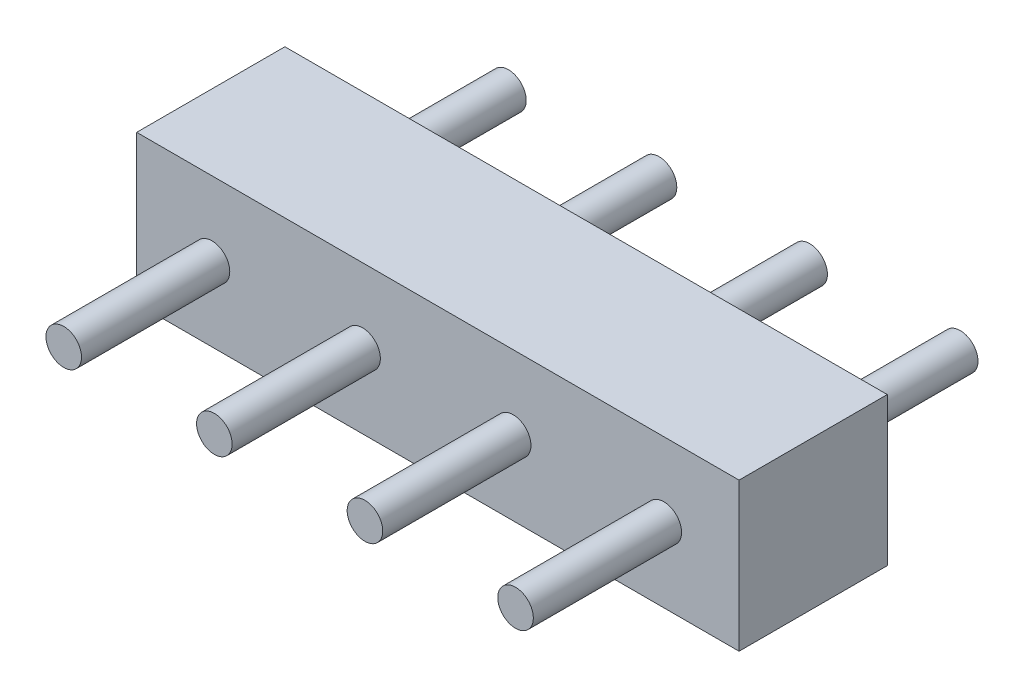
from build123d import *

# Parameters (mm, degrees)
SKETCH_1_W                 = 10.16
SKETCH_1_H                 = 2.5
EXTRUDE_1_DEPTH            = 2.5
EXTRUDE_START              = -5
SKETCH_2_R                 = 0.3
EXTRUDE_2_DEPTH            = 7.5
PATTERN_LINEAR_1_COUNT     = 3
PATTERN_LINEAR_1_PITCH     = 2.54
PATTERN_LINEAR_1_COL_COUNT = 2
PATTERN_LINEAR_1_COL_PITCH = 2.54


with BuildPart() as part:
    # 草图1 → 凸台-拉伸1 (new body)
    with BuildSketch(Plane.XY):
        with Locations((5.08, 1.25)):
            Rectangle(SKETCH_1_W, SKETCH_1_H)
    extrude(amount=EXTRUDE_1_DEPTH)

    # 草图2 → 凸台-拉伸2 (add)
    with BuildSketch(Plane.XY.offset(2.5).offset(EXTRUDE_START)):
        with Locations((3.81, 1.25)):
            Circle(SKETCH_2_R)
    extrude_2 = extrude(amount=EXTRUDE_2_DEPTH)

    # 阵列(线性)1: 凸台-拉伸2 ×3
    with Locations(*[(i * PATTERN_LINEAR_1_PITCH, 0, 0) for i in range(1, PATTERN_LINEAR_1_COUNT)]):
        add(extrude_2)

    # 阵列(线性)1 col: 凸台-拉伸2 ×2
    with Locations(*[(-i * PATTERN_LINEAR_1_COL_PITCH, 0, 0) for i in range(1, PATTERN_LINEAR_1_COL_COUNT)]):
        add(extrude_2)


solid = part.part
